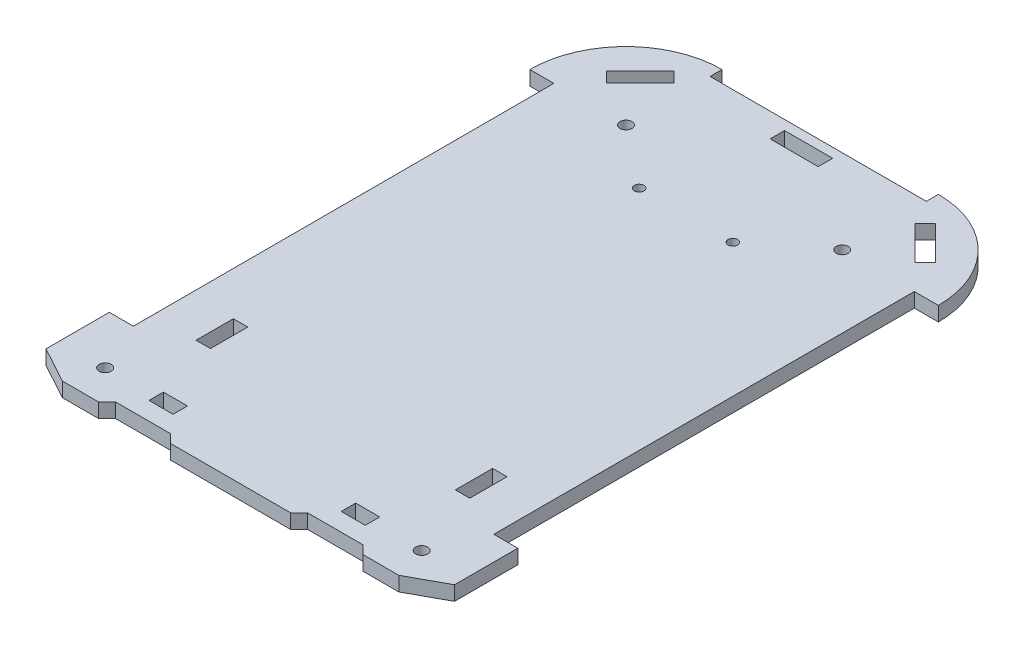
from build123d import *

# Parameters (mm, degrees)
SKETCH1_R           = 2.5
SKETCH1_R_2         = 2
SKETCH1_W           = 20
SKETCH1_H           = 6
SKETCH1_W_2         = 10
SKETCH1_W_3         = 6
SKETCH1_H_2         = 15.5
BOSS_EXTRUDE1_DEPTH = 6


with BuildPart() as part:
    # Sketch1 → Boss-Extrude1 (new body)
    with BuildSketch(Plane(origin=(0, 0, 0), x_dir=(1, 0, 0), z_dir=(0, 1, 0))):
        with BuildLine():
            Line((-45, 125.078427477), (-45, 120.078427477))
            Line((-45, 120.078427477), (45, 120.078427477))
            Line((45, 120.078427477), (45, 125.078427477))
            ThreePointArc((45, 125.078427477), (73.284271247, 113.362698724), (85, 85.078427477))
            Line((85, 85.078427477), (75, 85.078427477))
            Line((75, 85.078427477), (75, -89.921572523))
            Line((75, -89.921572523), (85, -89.921572523))
            Line((85, -89.921572523), (85, -116.261318485))
            Line((85, -116.261318485), (70.010138709, -124.471382126))
            Line((70.010138709, -124.471382126), (55.010138709, -124.450192088))
            Line((55.010138709, -124.450192088), (51.474604803, -120.914658182))
            Line((51.474604803, -120.914658182), (28.549864753, -120.914658182))
            Line((28.549864753, -120.914658182), (25.014330847, -124.450192088))
            Line((25.014330847, -124.450192088), (-24.985669153, -124.450192088))
            Line((-24.985669153, -124.450192088), (-28.521203059, -120.914658182))
            Line((-28.521203059, -120.914658182), (-51.44594311, -120.914658182))
            Line((-51.44594311, -120.914658182), (-54.981477016, -124.450192088))
            Line((-54.981477016, -124.450192088), (-69.981477016, -124.450192088))
            Line((-69.981477016, -124.450192088), (-85, -116.261318485))
            Line((-85, -116.261318485), (-85, -89.921572523))
            Line((-85, -89.921572523), (-75, -89.921572523))
            Line((-75, -89.921572523), (-75, 85.078427477))
            Line((-75, 85.078427477), (-85, 85.078427477))
            ThreePointArc((-85, 85.078427477), (-73.284271247, 113.362698724), (-45, 125.078427477))
        make_face()
        with Locations(Location((-45, 85.078427477, 0), (0, 0, 270))):
            Circle(SKETCH1_R, mode=Mode.SUBTRACT)
        with Locations(Location((45, 85.078427477, 0), (0, 0, 270))):
            Circle(SKETCH1_R, mode=Mode.SUBTRACT)
        with Locations(Location((-65.857864376, -110.779436899, 0), (0, 0, 270))):
            Circle(SKETCH1_R, mode=Mode.SUBTRACT)
        with Locations(Location((65.857864376, -110.779436899, 0), (0, 0, 90))):
            Circle(SKETCH1_R, mode=Mode.SUBTRACT)
        with Locations(Location((19.5, 65.078427477, 0), (0, 0, 270))):
            Circle(SKETCH1_R_2, mode=Mode.SUBTRACT)
        with Locations(Location((-19.5, 65.078427477, 0), (0, 0, 270))):
            Circle(SKETCH1_R_2, mode=Mode.SUBTRACT)
        Polygon((50.571600169, 109.810660524), (54.814240856, 114.053301211), (68.95637648, 99.911165587), (64.713735792, 95.6685249), align=None, mode=Mode.SUBTRACT)
        with Locations((0, 113.078427477)):
            Rectangle(SKETCH1_W, SKETCH1_H, mode=Mode.SUBTRACT)
        Polygon((-50.11039508, 110.271865613), (-64.252530704, 96.129729989), (-68.495171391, 100.372370676), (-54.353035767, 114.5145063), align=None, mode=Mode.SUBTRACT)
        with Locations((-39.983573085, -110.414658182)):
            Rectangle(SKETCH1_W_2, SKETCH1_H, mode=Mode.SUBTRACT)
        with Locations((40.012234778, -110.414658182)):
            Rectangle(SKETCH1_W_2, SKETCH1_H, mode=Mode.SUBTRACT)
        with Locations((54, -74.171572523)):
            Rectangle(SKETCH1_W_3, SKETCH1_H_2, mode=Mode.SUBTRACT)
        with Locations((-53.888870578, -74.171572523)):
            Rectangle(SKETCH1_W_3, SKETCH1_H_2, mode=Mode.SUBTRACT)
    extrude(amount=BOSS_EXTRUDE1_DEPTH)


solid = part.part
